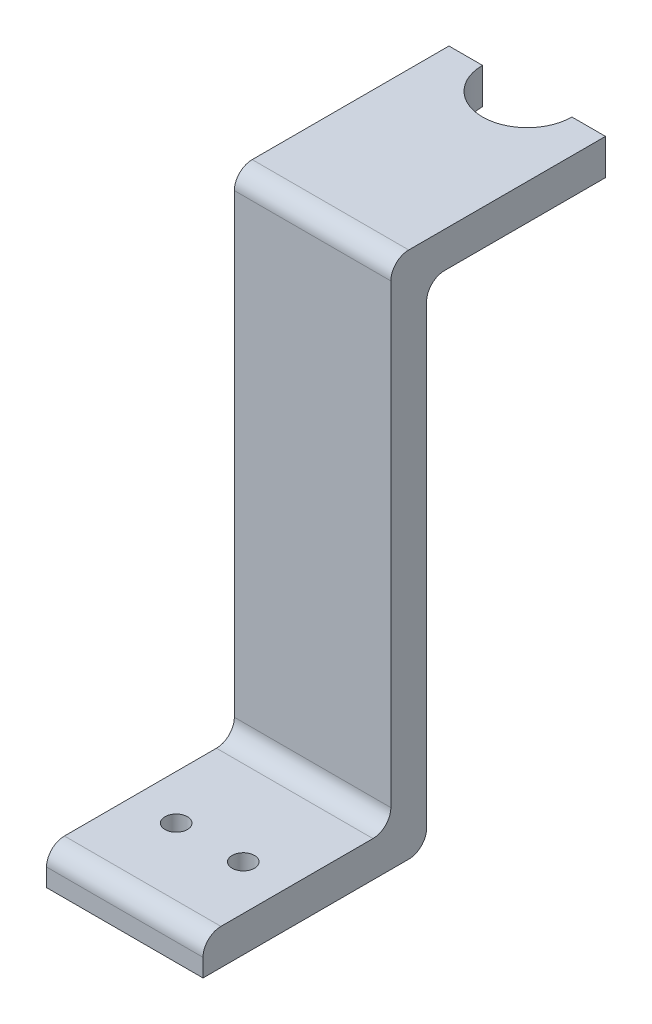
from build123d import *

# Parameters (mm, degrees)
BOSS_EXTRUDE1_DEPTH = 35
SKETCH2_R           = 10
CUT_EXTRUDE1_DEPTH  = 10
SKETCH3_R           = 2.5
CUT_EXTRUDE2_DEPTH  = 147.372811683


with BuildPart() as part:
    # Sketch1 → Boss-Extrude1 (new body)
    with BuildSketch(Plane(origin=(0, 0, 0), x_dir=(0, 0, -1), z_dir=(1, 0, 0))):
        with BuildLine():
            Line((0, 0), (0, 4))
            ThreePointArc((0, 4), (1.171572875, 6.828427125), (4, 8))
            Line((4, 8), (38, 8))
            ThreePointArc((38, 8), (40.828427125, 9.171572875), (42, 12))
            Line((42, 12), (42, 114))
            ThreePointArc((42, 114), (43.171572875, 116.828427125), (46, 118))
            Line((46, 118), (90, 118))
            Line((90, 118), (90, 110))
            Line((90, 110), (54, 110))
            ThreePointArc((54, 110), (51.171572875, 108.828427125), (50, 106))
            Line((50, 106), (50, 4))
            ThreePointArc((50, 4), (48.828427125, 1.171572875), (46, 0))
            Line((46, 0), (0, 0))
        make_face()
    extrude(amount=BOSS_EXTRUDE1_DEPTH)

    # Sketch2 → Cut-Extrude1 (cut)
    with BuildSketch(Plane(origin=(0, 118, 0), x_dir=(1, 0, 0), z_dir=(0, 1, 0))):
        with Locations((17.5, 90)):
            Circle(SKETCH2_R)
    extrude(amount=-CUT_EXTRUDE1_DEPTH, mode=Mode.SUBTRACT)

    # Sketch3 → Cut-Extrude2 (cut, through all)
    with BuildSketch(Plane(origin=(0, 8, 0), x_dir=(1, 0, 0), z_dir=(0, 1, 0))):
        with Locations(Location((10, 19, 0), (0, 0, 270))):
            Circle(SKETCH3_R)
        with Locations(Location((25, 19, 0), (0, 0, 270))):
            Circle(SKETCH3_R)
    extrude(amount=-CUT_EXTRUDE2_DEPTH, mode=Mode.SUBTRACT)


solid = part.part
